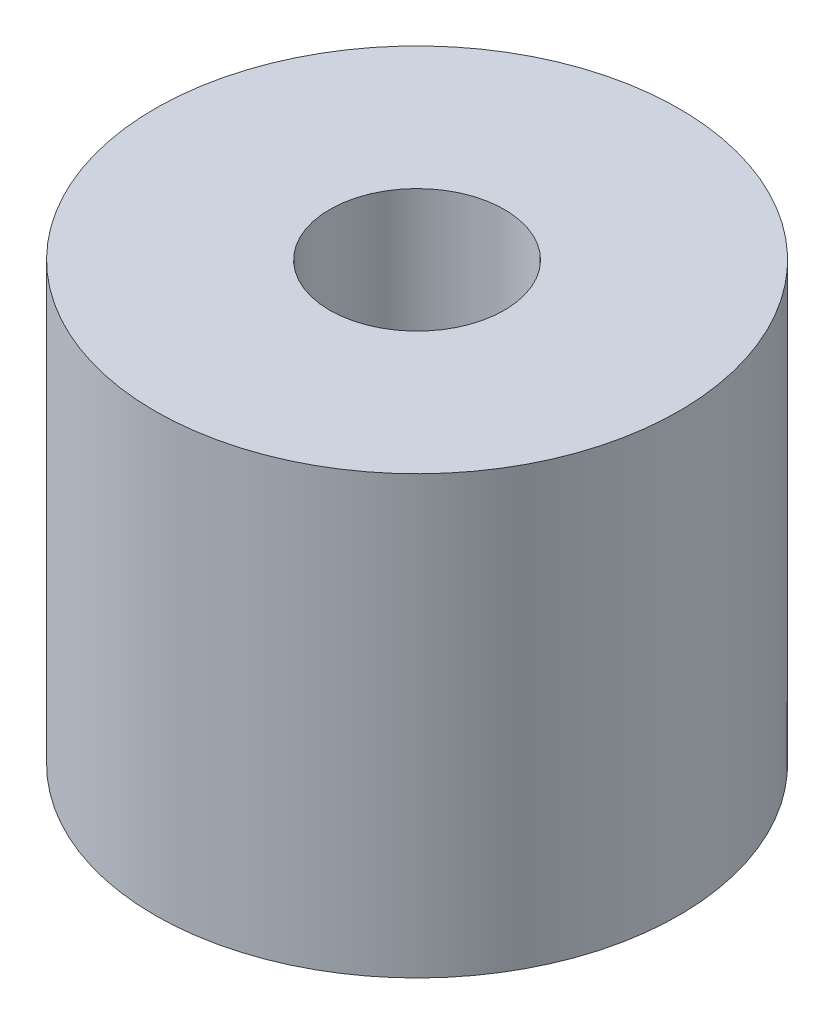
from build123d import *

# Parameters (mm, degrees)
SKETCH_1_R      = 15
SKETCH_1_R_2    = 5
EXTRUDE_1_DEPTH = 25


with BuildPart() as part:
    # Эскиз1 → Вытянуть1 (new body)
    with BuildSketch(Plane(origin=(0, 0, 0), x_dir=(1, 0, 0), z_dir=(0, 1, 0))):
        with Locations(Location((0, 0, 0), (0, 0, 270))):
            Circle(SKETCH_1_R)
        with Locations(Location((0, 0, 0), (0, 0, 270))):
            Circle(SKETCH_1_R_2, mode=Mode.SUBTRACT)
    extrude(amount=EXTRUDE_1_DEPTH)


solid = part.part
